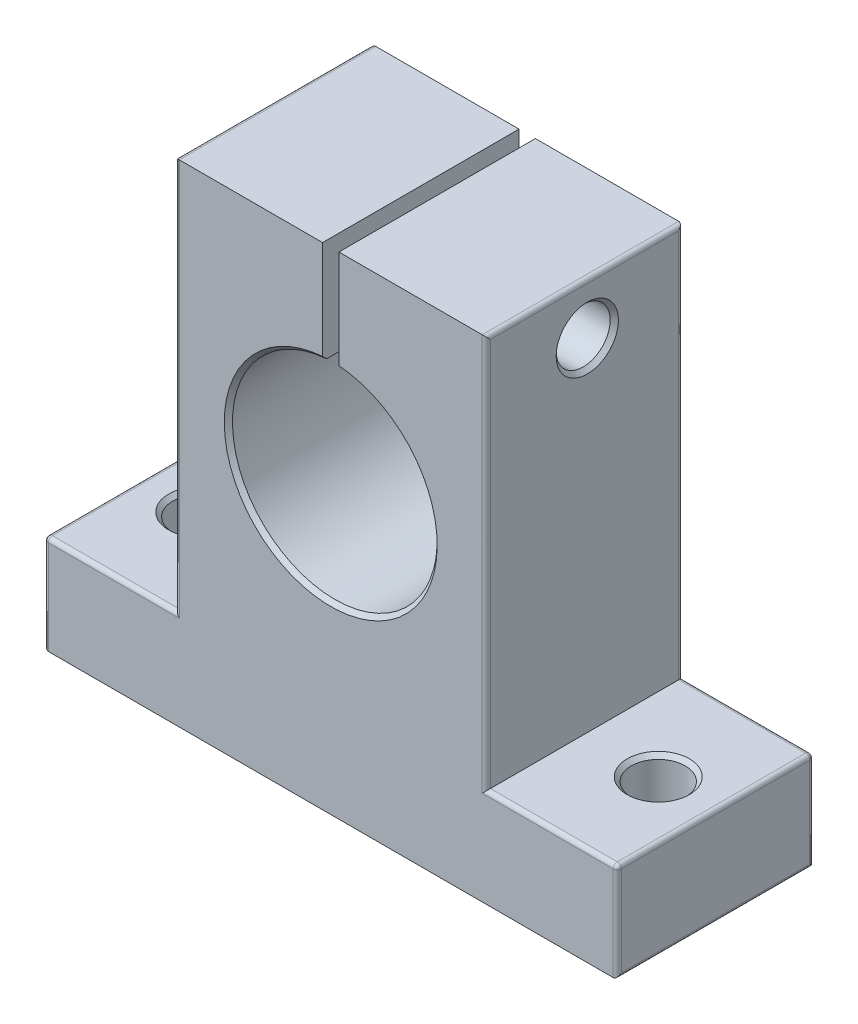
from build123d import *

# Parameters (mm, degrees)
BOSS_EXTRUDE1_DEPTH     = 12
SKETCH2_R               = 3.3
CUT_EXTRUDE1_DEPTH      = 61.605280298
CUT_EXTRUDE2_DEPTH      = 67
CUT_EXTRUDE2_DEPTH_BACK = 67
SKETCH5_R               = 3.3
CHAMFER2_SIZE           = 0.5
FILLET2_R               = 0.5


with BuildPart() as part:
    # Sketch1 → Boss-Extrude1 (new, symmetric)
    with BuildSketch(Plane.XY):
        with BuildLine():
            Line((-35, -6), (-35, 6))
            Line((-35, 6), (-19, 6))
            Line((-19, 6), (-19, 54))
            Line((-19, 54), (-1, 54))
            Line((-1, 54), (-1, 41.459935794))
            ThreePointArc((-1, 41.459935794), (0, 16.5), (1, 41.459935794))
            Line((1, 41.459935794), (1, 54))
            Line((1, 54), (19, 54))
            Line((19, 54), (19, 6))
            Line((19, 6), (35, 6))
            Line((35, 6), (35, -6))
            Line((35, -6), (-35, -6))
        make_face()
    extrude(amount=BOSS_EXTRUDE1_DEPTH, both=True)

    # Sketch2 → Cut-Extrude1 (cut, through all)
    with BuildSketch(Plane(origin=(0, 6, 0), x_dir=(1, 0, 0), z_dir=(0, 1, 0))):
        with Locations(Location((28, 0, 0), (0, 0, 180))):
            Circle(SKETCH2_R)
        with Locations((-28, 0)):
            Circle(SKETCH2_R)
    extrude(amount=-CUT_EXTRUDE1_DEPTH, mode=Mode.SUBTRACT)

    # Sketch5 → Cut-Extrude2 (cut, two sides: drawn at the far end of the back side and taken through both)
    with BuildSketch(Plane(origin=(-1, 0, 0), x_dir=(0, 0, -1), z_dir=(1, 0, 0)).offset(-CUT_EXTRUDE2_DEPTH_BACK)):
        with Locations((0.330734984, 47.729967897)):
            Circle(SKETCH5_R)
    extrude(amount=CUT_EXTRUDE2_DEPTH + CUT_EXTRUDE2_DEPTH_BACK, mode=Mode.SUBTRACT)

    # Chamfer2
    chamfer2_edges = [part.edges().sort_by_distance(p)[0] for p in [
        (0, 16.5, -12),
        (0, 16.5, 12),
        (31.3, 6, 0),
        (-31.3, 6, 0),
        (-19, 47.729967897, 2.969265016),
        (19, 47.729967897, 2.969265016),
    ]]
    chamfer(chamfer2_edges, length=CHAMFER2_SIZE)

    # Fillet2
    fillet2_edges = [part.edges().sort_by_distance(p)[0] for p in [
        (-27, 6, 12),
        (19, 30, -12),
        (27, 6, -12),
        (-35, 0, 12),
        (35, 0, -12),
        (-35, 0, -12),
        (-27, 6, -12),
        (-19, 30, -12),
        (35, 0, 12),
        (19, 54, 0),
        (35, 6, 0),
        (35, -6, 0),
        (-35, -6, 0),
        (-35, 6, 0),
        (-19, 54, 0),
        (27, 6, 12),
        (19, 30, 12),
        (-19, 30, 12),
    ]]
    fillet(fillet2_edges, radius=FILLET2_R)


solid = part.part
